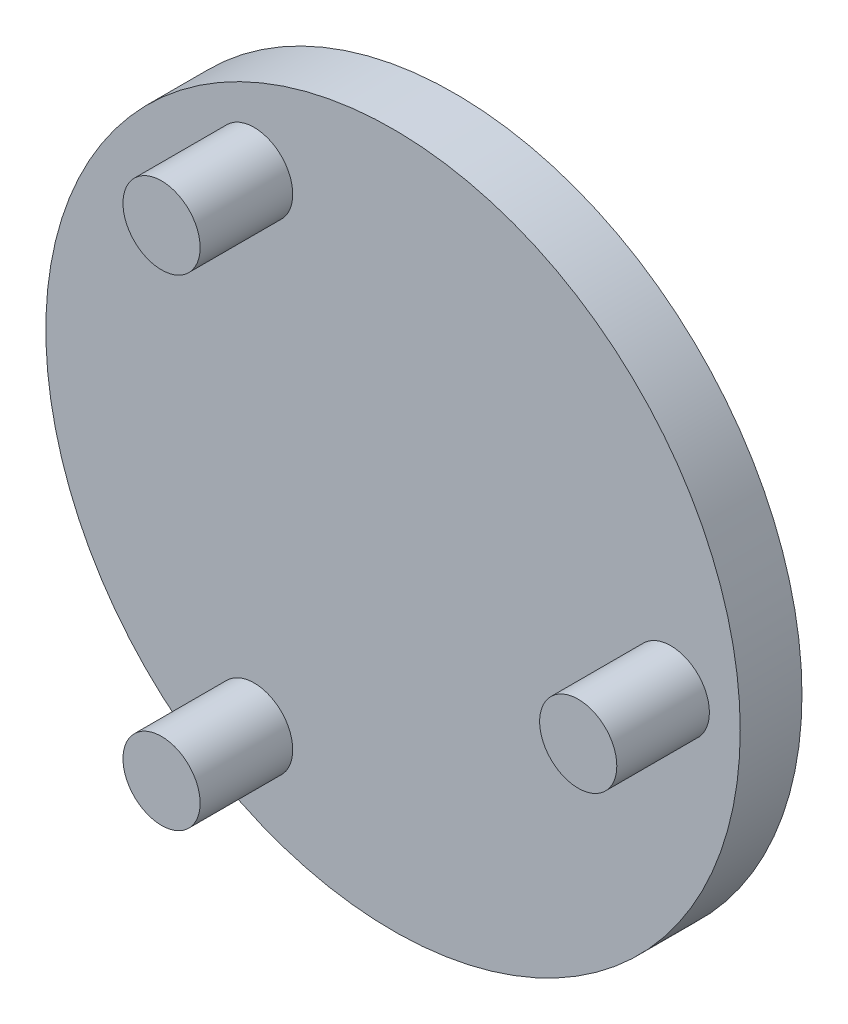
from build123d import *

# Parameters (mm, degrees)
SKETCH1_R           = 45
BOSS_EXTRUDE1_DEPTH = 8
SKETCH2_R           = 5
BOSS_EXTRUDE2_DEPTH = 12


with BuildPart() as part:
    # Sketch1 → Boss-Extrude1 (new body)
    with BuildSketch(Plane.XY):
        Circle(SKETCH1_R)
    extrude(amount=BOSS_EXTRUDE1_DEPTH)

    # Sketch2 → Boss-Extrude2 (add)
    with BuildSketch(Plane.XY.offset(8)):
        with Locations((36, 0)):
            Circle(SKETCH2_R)
        with Locations((-18, 31.176914536)):
            Circle(SKETCH2_R)
        with Locations((-18, -31.176914536)):
            Circle(SKETCH2_R)
    extrude(amount=BOSS_EXTRUDE2_DEPTH)


solid = part.part
